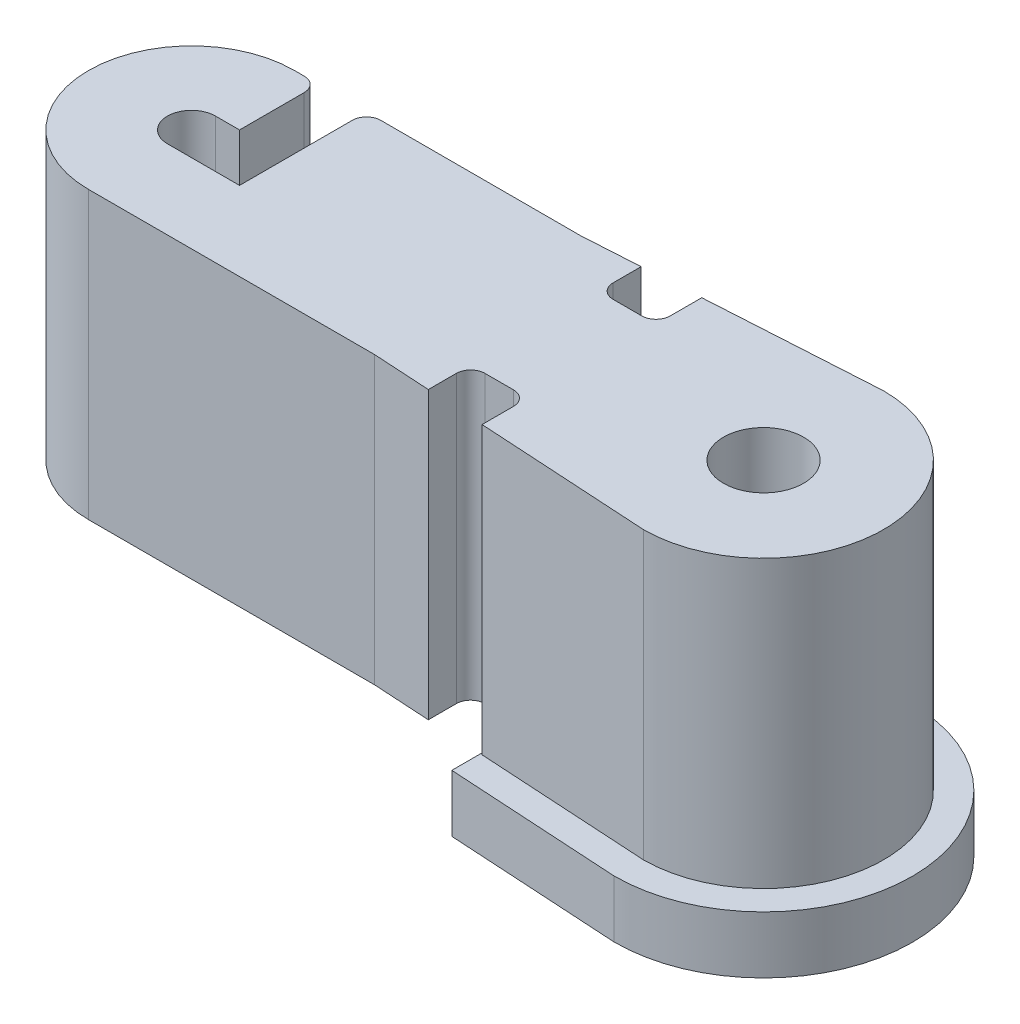
from build123d import *

# Parameters (mm, degrees)
BOSS_EXTRUDE1_DEPTH = 2.5
SKETCH4_R           = 0.35
THROUGH_HOLES_DEPTH = 7.493265742
FILLET1_R           = 0.125
SKETCH5_R           = 0.125
BOSS_EXTRUDE2_DEPTH = 0.5


with BuildPart() as part:
    # Sketch3 → Boss-Extrude1 (new body)
    with BuildSketch(Plane(origin=(0, 0, 0), x_dir=(1, 0, 0), z_dir=(0, 1, 0))):
        with BuildLine():
            Line((-2.5, 0.9), (-2, 0.93))
            Line((-2, 0.93), (-2, 0.56))
            Line((-2, 0.56), (-1.5, 0.56))
            Line((-1.5, 0.56), (-1.5, 0.96))
            Line((-1.5, 0.96), (0, 1.05))
            ThreePointArc((0, 1.05), (1.05, 0), (0, -1.05))
            Line((0, -1.05), (-1.5, -0.96))
            Line((-1.5, -0.96), (-1.5, -0.56))
            Line((-1.5, -0.56), (-2, -0.56))
            Line((-2, -0.56), (-2, -0.93))
            Line((-2, -0.93), (-2.5, -0.9))
            Line((-2.5, -0.9), (-5, -0.9))
            ThreePointArc((-5, -0.9), (-5.9, 0), (-5, 0.9))
            Line((-5, 0.9), (-2.5, 0.9))
        make_face()
    extrude(amount=BOSS_EXTRUDE1_DEPTH)

    # Sketch4 → Through Holes (cut, through all)
    with BuildSketch(Plane(origin=(0, 2.5, 0), x_dir=(1, 0, 0), z_dir=(0, 1, 0))):
        with BuildLine():
            Line((-4.37, 0.9), (-4.79, 0.9))
            Line((-4.79, 0.9), (-4.79, 0.21))
            Line((-4.79, 0.21), (-5, 0.21))
            ThreePointArc((-5, 0.21), (-5.21, 0), (-5, -0.21))
            Line((-5, -0.21), (-4.37, -0.21))
            Line((-4.37, -0.21), (-4.37, 0.9))
        make_face()
        with Locations(Location((0, 0, 0), (0, 0, 270))):
            Circle(SKETCH4_R)
    extrude(amount=-THROUGH_HOLES_DEPTH, mode=Mode.SUBTRACT)

    # Fillet1
    fillet1_edges = [part.edges().sort_by_distance(p)[0] for p in [
        (-2, 1.25, 0.56),
        (-1.5, 1.25, 0.56),
        (-1.5, 1.25, -0.56),
        (-2, 1.25, -0.56),
        (-4.79, 1.25, -0.9),
        (-4.37, 1.25, -0.9),
    ]]
    fillet(fillet1_edges, radius=FILLET1_R)

    # Sketch5 → Boss-Extrude2 (add)
    with BuildSketch(Plane(origin=(0, 0, 0), x_dir=(1, 0, 0), z_dir=(0, 1, 0))):
        with BuildLine():
            Line((-1.514973073, -1.209551211), (-1.514973073, 1.209551211))
            Line((-1.514973073, 1.209551211), (-0.007892579, 1.299976041))
            ThreePointArc((-0.007892579, 1.299976041), (1.3, 0), (-0.007892579, -1.299976041))
            Line((-0.007892579, -1.299976041), (-1.514973073, -1.209551211))
        make_face()
        with Locations(Location((0, 0, 0), (0, 0, 270))):
            Circle(SKETCH5_R, mode=Mode.SUBTRACT)
    extrude(amount=-BOSS_EXTRUDE2_DEPTH)


solid = part.part
